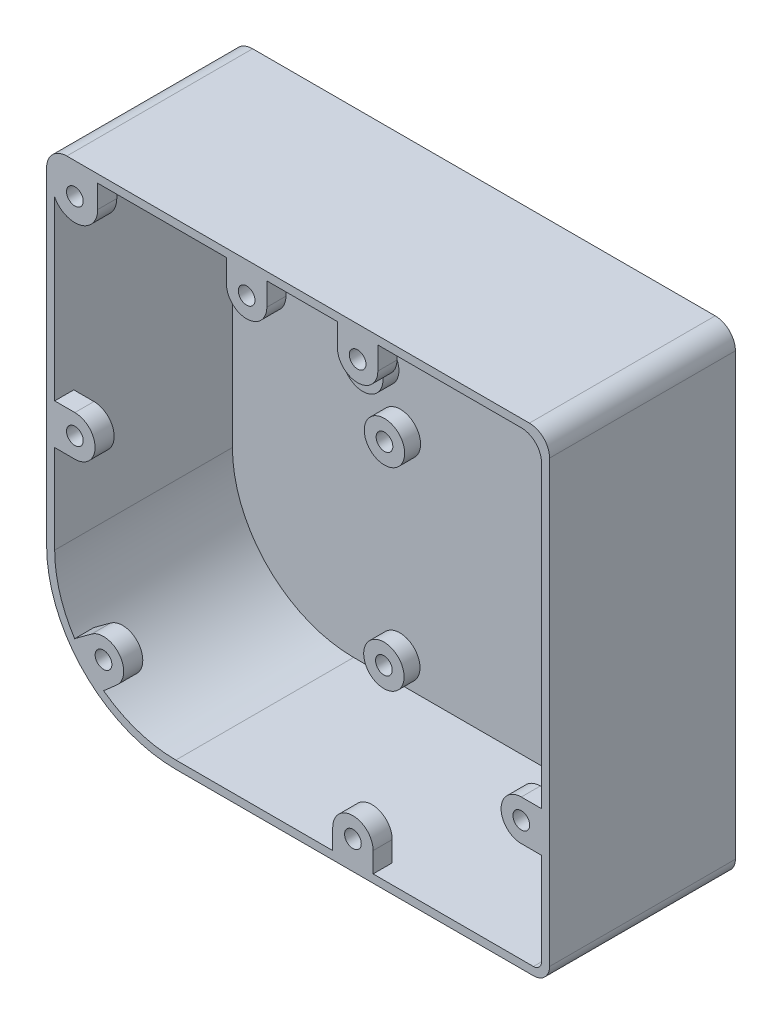
from build123d import *

# Parameters (mm, degrees)
SKETCH5_W           = 153.063311942
SKETCH5_H           = 144.779998932
BOSS_EXTRUDE4_DEPTH = 55.88
FILLET1_R           = 38.1
FILLET2_R           = 2.54
SHELL3_T            = 2.54
SKETCH7_R           = 6.35
BOSS_EXTRUDE5_DEPTH = 5
SKETCH8_R           = 2.625
CUT_EXTRUDE1_DEPTH  = 5
BOSS_EXTRUDE6_DEPTH = 6
FILLET3_R           = 6.35
SKETCH10_R          = 2.625
CUT_EXTRUDE2_DEPTH  = 55.88


with BuildPart() as part:
    # Sketch5 → Boss-Extrude4 (new body)
    with BuildSketch(Plane.XY):
        with Locations((56.058995854, 50.442319529)):
            Rectangle(SKETCH5_W, SKETCH5_H)
    extrude(amount=BOSS_EXTRUDE4_DEPTH)

    # Fillet1
    fillet1_edges = [part.edges().sort_by_distance(p)[0] for p in [
        (-20.472660117, -21.947679937, 27.94),
    ]]
    fillet(fillet1_edges, radius=FILLET1_R)

    # Fillet2
    fillet2_edges = [part.edges().sort_by_distance(p)[0] for p in [
        (132.590651825, -21.947679937, 27.94),
    ]]
    fillet(fillet2_edges, radius=FILLET2_R)

    # Shell3
    shell3_openings = [part.faces().sort_by_distance(p)[0] for p in [
        (57.024076911, 51.357711543, 55.88),
    ]]
    offset(amount=SHELL3_T, openings=shell3_openings, kind=Kind.INTERSECTION)

    # Sketch7 → Boss-Extrude5 (add)
    with BuildSketch(Plane.XY):
        with Locations((122.578533424, 47.648321467)):
            Circle(SKETCH7_R)
        with Locations((121.562533424, -13.311678533)):
            Circle(SKETCH7_R)
        with Locations((32.336533424, 46.631321467)):
            Circle(SKETCH7_R)
        with Locations((32.154533424, -14.327678533)):
            Circle(SKETCH7_R)
        with Locations((125.224651703, 115.212321803)):
            Circle(SKETCH7_R)
        with Locations((125.224651703, 63.269321803)):
            Circle(SKETCH7_R)
        with Locations((25.510651703, 115.337321803)):
            Circle(SKETCH7_R)
        with Locations((25.529651703, 63.269321803)):
            Circle(SKETCH7_R)
    extrude(amount=BOSS_EXTRUDE5_DEPTH)

    # Sketch8 → Cut-Extrude1 (cut)
    with BuildSketch(Plane.XY.offset(5)):
        with Locations((25.510651703, 115.337321803)):
            Circle(SKETCH8_R)
        with Locations((25.529651703, 63.269321803)):
            Circle(SKETCH8_R)
        with Locations((32.336533424, 46.631321467)):
            Circle(SKETCH8_R)
        with Locations((32.154533424, -14.327678533)):
            Circle(SKETCH8_R)
        with Locations((125.224651703, 63.269321803)):
            Circle(SKETCH8_R)
        with Locations((125.224651703, 115.212321803)):
            Circle(SKETCH8_R)
        with Locations((122.578533424, 47.648321467)):
            Circle(SKETCH8_R)
        with Locations((121.562533424, -13.311678533)):
            Circle(SKETCH8_R)
    extrude(amount=-CUT_EXTRUDE1_DEPTH, mode=Mode.SUBTRACT)

    # Sketch9 → Boss-Extrude6 (add)
    with BuildSketch(Plane.XY.offset(55.88)):
        with BuildLine():
            Line((-6.94761595, 115.657274828), (-6.94761595, 122.832318995))
            Line((-6.94761595, 122.832318995), (-20.472660117, 122.832318995))
            Line((-20.472660117, 122.832318995), (-20.472660117, 115.657274828))
            Line((-20.472660117, 115.657274828), (-20.472660117, 112.316801987))
            ThreePointArc((-20.472660117, 112.316801987), (-12.402234539, 108.691544814), (-6.94761595, 115.657274828))
        make_face()
        with BuildLine():
            Line((33.530571418, 115.657274828), (33.530571418, 122.832318995))
            Line((33.530571418, 122.832318995), (46.230571418, 122.832318995))
            Line((46.230571418, 122.832318995), (46.230571418, 115.657274828))
            ThreePointArc((46.230571418, 115.657274828), (39.880571418, 109.307274828), (33.530571418, 115.657274828))
        make_face()
        with BuildLine():
            Line((68.427420291, 115.710615977), (68.427420291, 122.832318995))
            Line((68.427420291, 122.832318995), (81.127420291, 122.832318995))
            Line((81.127420291, 122.832318995), (81.127420291, 115.710615977))
            ThreePointArc((81.127420291, 115.710615977), (74.777420291, 109.360615977), (68.427420291, 115.710615977))
        make_face()
        with BuildLine():
            Line((126.240651825, 22.296756738), (132.590651825, 22.296756738))
            Line((132.590651825, 22.296756738), (132.590651825, 9.596756738))
            Line((132.590651825, 9.596756738), (126.240651825, 9.596756738))
            ThreePointArc((126.240651825, 9.596756738), (119.890651825, 15.946756738), (126.240651825, 22.296756738))
        make_face()
        with BuildLine():
            Line((-8.880464125, -0.896351485), (-14.122660117, -4.742228331))
            ThreePointArc((-14.122660117, -4.742228331), (-11.33604945, -11.201095808), (-5.089054035, -14.434857763))
            Line((-5.089054035, -14.434857763), (-0.935149274, -10.7884483))
            ThreePointArc((-0.935149274, -10.7884483), (-0.173505163, -2.039817183), (-8.880464125, -0.896351485))
        make_face()
        with BuildLine():
            Line((-14.122660117, 56.792319529), (-20.472660117, 56.792319529))
            Line((-20.472660117, 56.792319529), (-20.472660117, 44.092319529))
            Line((-20.472660117, 44.092319529), (-14.122660117, 44.092319529))
            ThreePointArc((-14.122660117, 44.092319529), (-7.772660117, 50.442319529), (-14.122660117, 56.792319529))
        make_face()
        with BuildLine():
            Line((66.946411889, -15.597679937), (66.946411889, -21.947679937))
            Line((66.946411889, -21.947679937), (79.646411889, -21.947679937))
            Line((79.646411889, -21.947679937), (79.646411889, -15.597679937))
            ThreePointArc((79.646411889, -15.597679937), (73.296411889, -9.247679937), (66.946411889, -15.597679937))
        make_face()
    extrude(amount=-BOSS_EXTRUDE6_DEPTH)

    # Fillet3
    fillet3_edges = [part.edges().sort_by_distance(p)[0] for p in [
        (-20.472660117, 122.832318995, 24.94),
        (132.590651825, 122.832318995, 27.94),
        (-23.012660117, 125.372318995, 26.67),
        (135.130651825, 125.372318995, 26.67),
    ]]
    fillet(fillet3_edges, radius=FILLET3_R)

    # Sketch10 → Cut-Extrude2 (cut)
    with BuildSketch(Plane.XY.offset(55.88)):
        with Locations((-14.122660117, 115.657274828)):
            Circle(SKETCH10_R)
        with Locations((39.880571418, 115.657274828)):
            Circle(SKETCH10_R)
        with Locations((74.777420291, 115.710615977)):
            Circle(SKETCH10_R)
        with Locations((-14.122660117, 50.442319529)):
            Circle(SKETCH10_R)
        with Locations((-5.124288877, -6.016277999)):
            Circle(SKETCH10_R)
        with Locations((73.296411889, -15.597679937)):
            Circle(SKETCH10_R)
        with Locations((126.240651825, 15.946756738)):
            Circle(SKETCH10_R)
    extrude(amount=-CUT_EXTRUDE2_DEPTH, mode=Mode.SUBTRACT)


solid = part.part
